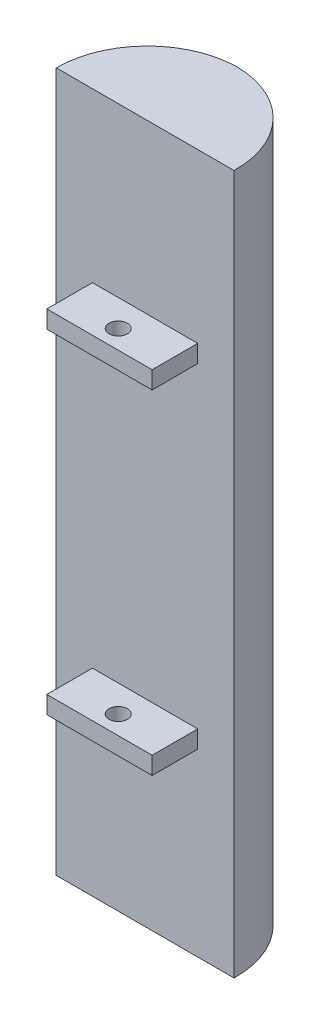
from build123d import *

# Parameters (mm, degrees)
BOSS_EXTRUDE1_DEPTH     = 598
SKETCH2_W               = 90
SKETCH2_H               = 15
BOSS_EXTRUDE2_DEPTH     = 39
CUT_EXTRUDE1_DEPTH      = 458.203414552
CUT_EXTRUDE1_DEPTH_BACK = 458.203414552
SKETCH3_R               = 7.875


with BuildPart() as part:
    # Sketch1 → Boss-Extrude1 (new body)
    with BuildSketch(Plane(origin=(0, 0, 0), x_dir=(1, 0, 0), z_dir=(0, 1, 0))):
        with BuildLine():
            Line((-76, 0), (76, 0))
            ThreePointArc((76, 0), (54.45181356, 55.029972187), (0, 78))
            ThreePointArc((0, 78), (-53.858440233, 54.45181356), (-76, 0))
        make_face()
    extrude(amount=BOSS_EXTRUDE1_DEPTH)

    # Sketch2 → Boss-Extrude2 (add)
    with BuildSketch(Plane.XY):
        with Locations((0, 446.94016831)):
            Rectangle(SKETCH2_W, SKETCH2_H)
        with Locations((0, 161.460515061)):
            Rectangle(SKETCH2_W, SKETCH2_H)
    extrude(amount=BOSS_EXTRUDE2_DEPTH)

    # Sketch3 → Cut-Extrude1 (cut, two sides: drawn at the far end of the back side and taken through both)
    with BuildSketch(Plane(origin=(0, 153.960515061, 0), x_dir=(-1, 0, 0), z_dir=(0, -1, 0)).offset(-CUT_EXTRUDE1_DEPTH_BACK)):
        with Locations(Location((0, -22.983942377, 0), (0, 0, 90))):
            Circle(SKETCH3_R)
    extrude(amount=CUT_EXTRUDE1_DEPTH + CUT_EXTRUDE1_DEPTH_BACK, mode=Mode.SUBTRACT)


solid = part.part
